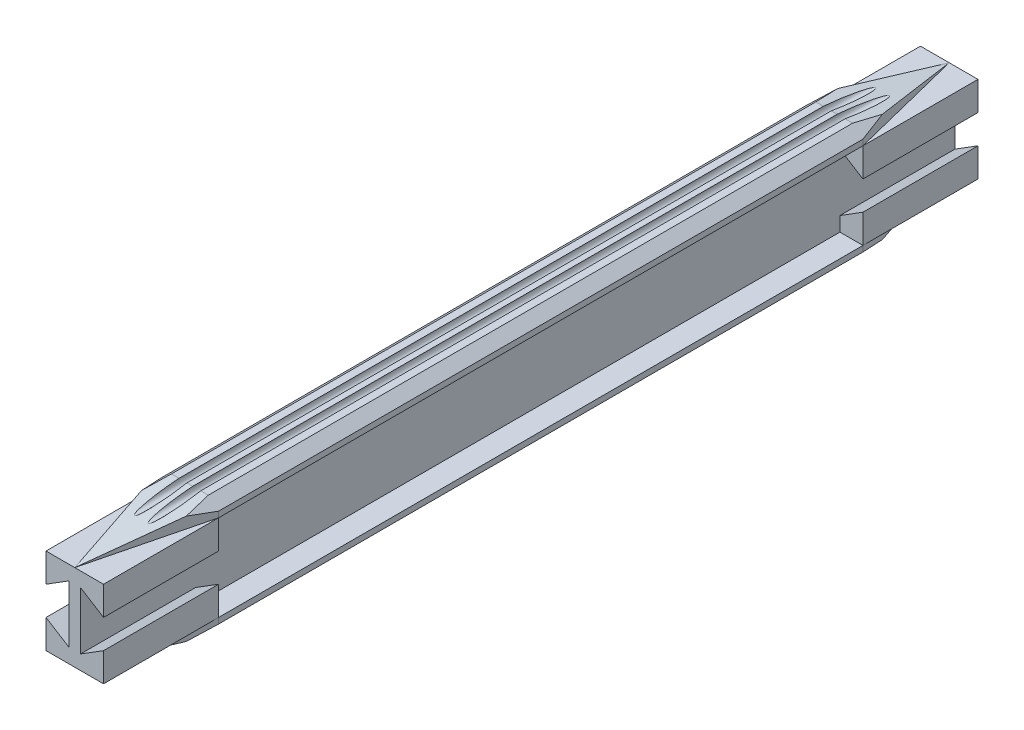
from build123d import *

# Parameters (mm, degrees)
SKETCH1_W               = 152
SKETCH1_H               = 15
BOSS_EXTRUDE1_DEPTH     = 1
SKETCH2_W               = 20
SKETCH2_H               = 15
BOSS_EXTRUDE2_DEPTH     = 4
CUT_EXTRUDE1_DEPTH      = 133.3074072
MIRROR2_COPY_1_SKETCH_W = 20
MIRROR2_COPY_1_SKETCH_H = 15
MIRROR2_COPY_1_DEPTH    = 4
MIRROR2_COPY_2_DEPTH    = 133.3074072
BOSS_EXTRUDE5_DEPTH     = 2.5
CUT_EXTRUDE2_DEPTH      = 78.30459236
SKETCH9_R               = 0.75
CUT_EXTRUDE3_DEPTH      = 153.410629551
CUT_EXTRUDE4_DEPTH      = 153.410629551


with BuildPart() as part:
    # Sketch1 → Boss-Extrude1 (new, symmetric)
    with BuildSketch(Plane(origin=(0, 0, 0), x_dir=(0, 0, -1), z_dir=(1, 0, 0))):
        Rectangle(SKETCH1_W, SKETCH1_H)
    extrude(amount=BOSS_EXTRUDE1_DEPTH, both=True)

    # Sketch2 → Boss-Extrude2 (add)
    with BuildSketch(Plane(origin=(1, 0, 0), x_dir=(0, 0, -1), z_dir=(1, 0, 0))):
        with Locations((66, 0)):
            Rectangle(SKETCH2_W, SKETCH2_H)
    boss_extrude2 = extrude(amount=BOSS_EXTRUDE2_DEPTH)

    # Sketch3 → Cut-Extrude1 (cut, through all)
    with BuildSketch(Plane.XY.offset(-56)):
        Polygon((5, 2.5), (1, 5), (1, -5), (5, -2.5), align=None)
    cut_extrude1 = extrude(amount=-CUT_EXTRUDE1_DEPTH, mode=Mode.SUBTRACT)

    # Mirror1: Boss-Extrude2, Cut-Extrude1 across plane
    add(boss_extrude2.mirror(Plane(origin=(0, 0, 0), x_dir=(0, 0, 1), z_dir=(1, 0, 0))))
    add(cut_extrude1.mirror(Plane(origin=(0, 0, 0), x_dir=(0, 0, 1), z_dir=(1, 0, 0))), mode=Mode.SUBTRACT)

    # Mirror2: Boss-Extrude2, Cut-Extrude1 across plane
    add(boss_extrude2.mirror(Plane.XY))
    add(cut_extrude1.mirror(Plane.XY), mode=Mode.SUBTRACT)

    # Mirror2 copy 1 sketch → Mirror2 copy 1 (add)
    with BuildSketch(Plane.ZY.offset(1)):
        with Locations((66, 0)):
            Rectangle(MIRROR2_COPY_1_SKETCH_W, MIRROR2_COPY_1_SKETCH_H)
    extrude(amount=MIRROR2_COPY_1_DEPTH)

    # Mirror2 copy 2 sketch → Mirror2 copy 2 (cut, through all)
    with BuildSketch(Plane(origin=(0, 0, 56), x_dir=(-1, 0, 0), z_dir=(0, 0, -1))):
        Polygon((5, 2.5), (1, 5), (1, -5), (5, -2.5), align=None)
    extrude(amount=-MIRROR2_COPY_2_DEPTH, mode=Mode.SUBTRACT)

    # Sketch7 → Boss-Extrude5 (add)
    with BuildSketch(Plane(origin=(0, 7.5, 0), x_dir=(1, 0, 0), z_dir=(0, 1, 0))):
        Polygon((0, -76), (-5, -56), (-5, 56), (0, 76), (5, 56), (5, -56), align=None)
    boss_extrude5 = extrude(amount=BOSS_EXTRUDE5_DEPTH)

    # Sketch8 → Cut-Extrude2 (cut, through all)
    with BuildSketch(Plane.ZY.offset(5)):
        Polygon((-56, 10), (-76, 7.5), (-76, 10), align=None)
        Polygon((76, 10), (56, 10), (76, 7.5), align=None)
    cut_extrude2 = extrude(amount=-CUT_EXTRUDE2_DEPTH, mode=Mode.SUBTRACT)

    # Sketch9 → Cut-Extrude3 (cut, through all)
    with BuildSketch(Plane.XY.offset(76)):
        with Locations((1.2, 9.7)):
            Circle(SKETCH9_R)
        with Locations((-1.2, 9.7)):
            Circle(SKETCH9_R)
    cut_extrude3 = extrude(amount=-CUT_EXTRUDE3_DEPTH, mode=Mode.SUBTRACT)

    # Mirror4: Boss-Extrude5, Cut-Extrude2, Cut-Extrude3 across plane
    add(boss_extrude5.mirror(Plane.ZX))
    add(cut_extrude2.mirror(Plane.ZX), mode=Mode.SUBTRACT)
    add(cut_extrude3.mirror(Plane.ZX), mode=Mode.SUBTRACT)

    # Sketch10 → Cut-Extrude4 (cut, through all)
    with BuildSketch(Plane(origin=(0, 0, -76), x_dir=(-1, 0, 0), z_dir=(0, 0, -1))):
        Polygon((-5, 8.5), (-3.2, 10), (-5, 10), align=None)
        Polygon((5, 10), (5, 8.5), (3.2, 10), align=None)
        Polygon((-5, -10), (-5, -8.5), (-3.2, -10), align=None)
        Polygon((5, -8.5), (3.2, -10), (5, -10), align=None)
    extrude(amount=-CUT_EXTRUDE4_DEPTH, mode=Mode.SUBTRACT)


solid = part.part
